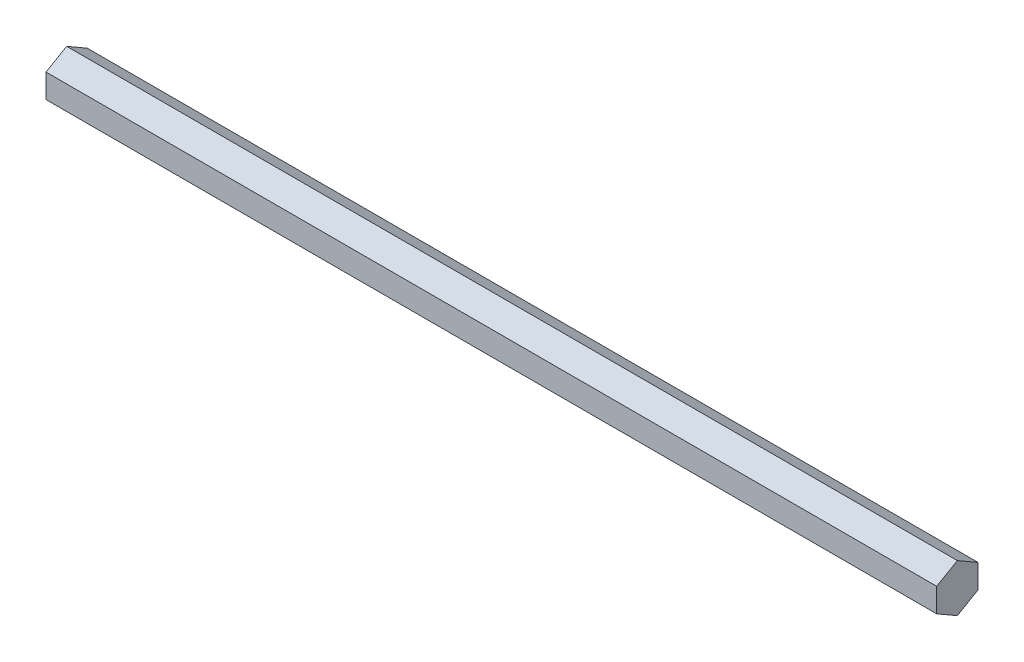
from build123d import *

# Parameters (mm, degrees)
AXLE_DEPTH       = 177.8
DRIVE_SLOT_DEPTH = 13.97


with BuildPart() as part:
    # Hex Profile → Axle (new body)
    with BuildSketch(Plane(origin=(0, 0, 0), x_dir=(0, 0, -1), z_dir=(1, 0, 0))):
        Polygon((4.124445986, -2.38125), (4.124445986, 2.38125), (0, 4.7625), (-4.124445986, 2.38125), (-4.124445986, -2.38125), (0, -4.7625), align=None)
    extrude(amount=AXLE_DEPTH)

    # Motor Shaft Profile → Drive  Slot (cut)
    with BuildSketch(Plane.ZY):
        with BuildLine():
            Line((-1.669458355, 2.4892), (1.669458355, 2.4892))
            ThreePointArc((1.669458355, 2.4892), (0, -2.9972), (-1.669458355, 2.4892))
        make_face()
    extrude(amount=-DRIVE_SLOT_DEPTH, mode=Mode.SUBTRACT)


solid = part.part
